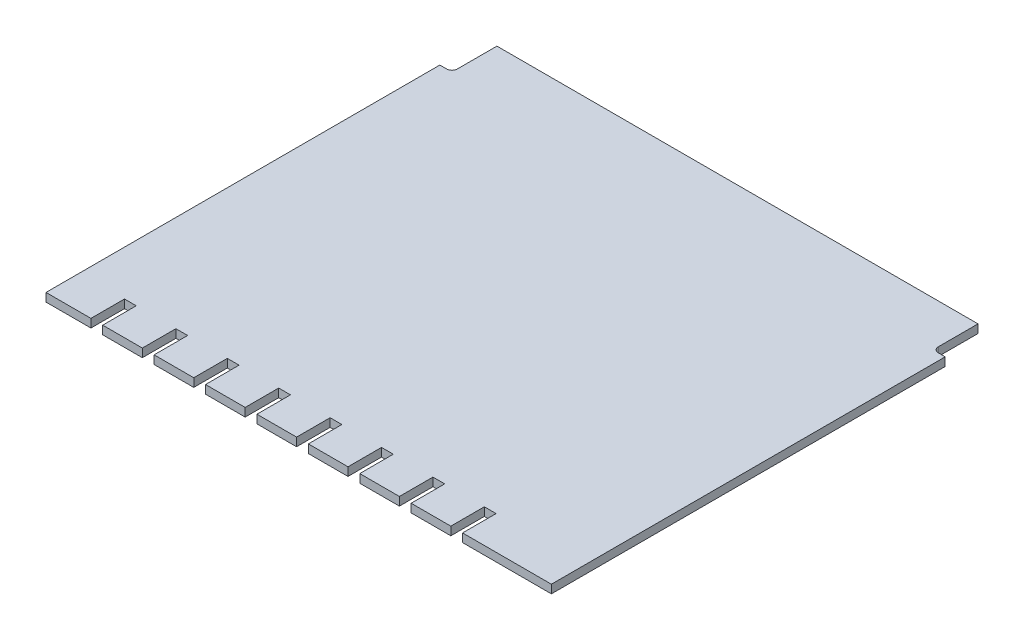
from build123d import *

# Parameters (mm, degrees)
BOSS_EXTRUDE1_DEPTH = 1.5875


with BuildPart() as part:
    # Sketch1 → Boss-Extrude1 (new body)
    with BuildSketch(Plane(origin=(0, 0, 0), x_dir=(1, 0, 0), z_dir=(0, 1, 0))):
        with BuildLine():
            Line((4.5, 75.5), (4.5, 83))
            Line((4.5, 83), (95.5, 83))
            Line((95.5, 83), (95.5, 75.5))
            ThreePointArc((95.5, 75.5), (95.792893219, 74.792893219), (96.5, 74.5))
            Line((96.5, 74.5), (97.8, 74.5))
            Line((97.8, 74.5), (97.8, 0))
            Line((97.8, 0), (81, 0))
            Line((81, 0), (81, 6.344902398))
            Line((81, 6.344902398), (78.775, 6.344902398))
            Line((78.775, 6.344902398), (78.775, 0))
            Line((78.775, 0), (71.275, 0))
            Line((71.275, 0), (71.275, 6.344902398))
            Line((71.275, 6.344902398), (69.05, 6.344902398))
            Line((69.05, 6.344902398), (69.05, 0))
            Line((69.05, 0), (61.55, 0))
            Line((61.55, 0), (61.55, 6.344902398))
            Line((61.55, 6.344902398), (59.325, 6.344902398))
            Line((59.325, 6.344902398), (59.325, 0))
            Line((59.325, 0), (51.825, 0))
            Line((51.825, 0), (51.825, 6.344902398))
            Line((51.825, 6.344902398), (49.6, 6.344902398))
            Line((49.6, 6.344902398), (49.6, 0))
            Line((49.6, 0), (42.1, 0))
            Line((42.1, 0), (42.1, 6.344902398))
            Line((42.1, 6.344902398), (39.875, 6.344902398))
            Line((39.875, 6.344902398), (39.875, 0))
            Line((39.875, 0), (32.375, 0))
            Line((32.375, 0), (32.375, 6.344902398))
            Line((32.375, 6.344902398), (30.15, 6.344902398))
            Line((30.15, 6.344902398), (30.15, 0))
            Line((30.15, 0), (22.65, 0))
            Line((22.65, 0), (22.65, 6.344902398))
            Line((22.65, 6.344902398), (20.425, 6.344902398))
            Line((20.425, 6.344902398), (20.425, 0))
            Line((20.425, 0), (12.925, 0))
            Line((12.925, 0), (12.925, 6.344902398))
            Line((12.925, 6.344902398), (10.7, 6.344902398))
            Line((10.7, 6.344902398), (10.7, 0))
            Line((10.7, 0), (2.2, 0))
            Line((2.2, 0), (2.2, 74.5))
            Line((2.2, 74.5), (3.5, 74.5))
            ThreePointArc((3.5, 74.5), (4.207106781, 74.792893219), (4.5, 75.5))
        make_face()
    extrude(amount=BOSS_EXTRUDE1_DEPTH)


solid = part.part
